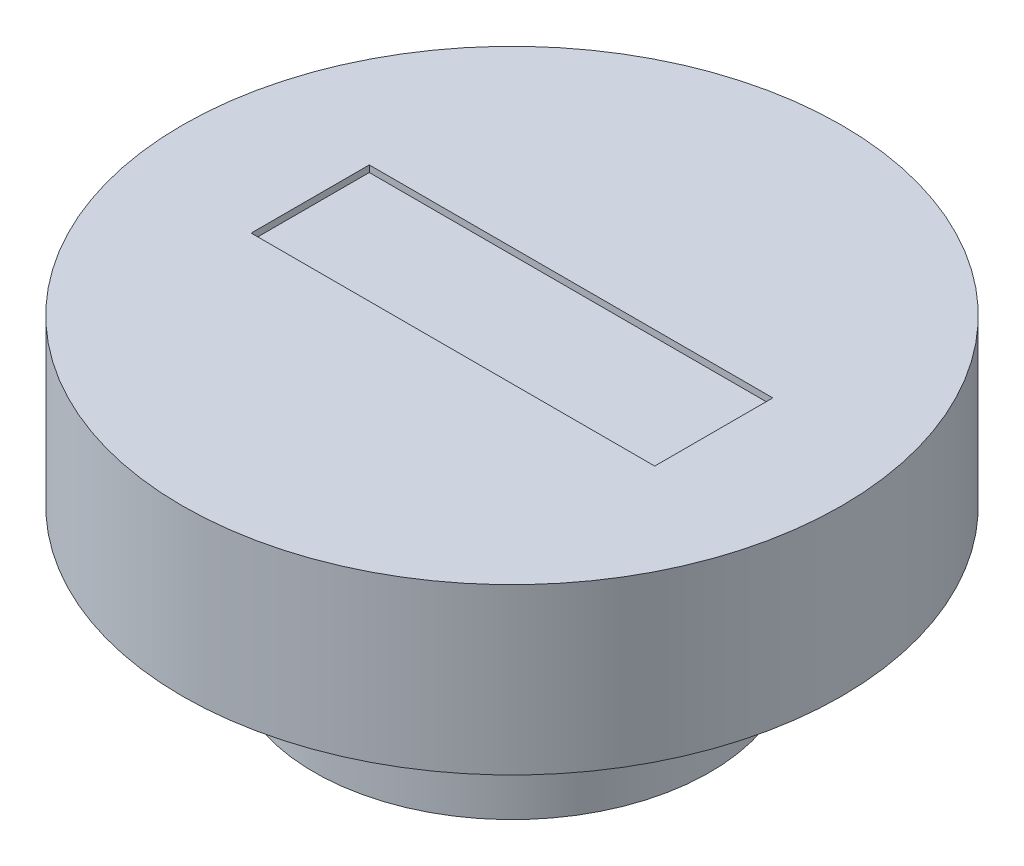
from build123d import *

# Parameters (mm, degrees)
SKETCH_1_R          = 10
EXTRUDE_1_DEPTH     = 5
SKETCH_2_R          = 6
EXTRUDE_2_DEPTH     = 4
SKETCH_3_W          = 12.239393476
SKETCH_3_H          = 3.581573668
CUT_EXTRUDE_1_DEPTH = 0.2


with BuildPart() as part:
    # 草图1 → 凸台-拉伸1 (new body)
    with BuildSketch(Plane(origin=(0, 0, 0), x_dir=(1, 0, 0), z_dir=(0, 1, 0))):
        with Locations(Location((0, 0, 0), (0, 0, 270))):
            Circle(SKETCH_1_R)
    extrude(amount=EXTRUDE_1_DEPTH)

    # 草图2 → 凸台-拉伸2 (add)
    with BuildSketch(Plane.XZ):
        with Locations(Location((0, 0, 0), (0, 0, 270))):
            Circle(SKETCH_2_R)
    extrude(amount=EXTRUDE_2_DEPTH)

    # 草图3 → 切除-拉伸1 (cut)
    with BuildSketch(Plane(origin=(0, 5, 0), x_dir=(1, 0, 0), z_dir=(0, 1, 0))):
        Rectangle(SKETCH_3_W, SKETCH_3_H)
    extrude(amount=-CUT_EXTRUDE_1_DEPTH, mode=Mode.SUBTRACT)


solid = part.part
